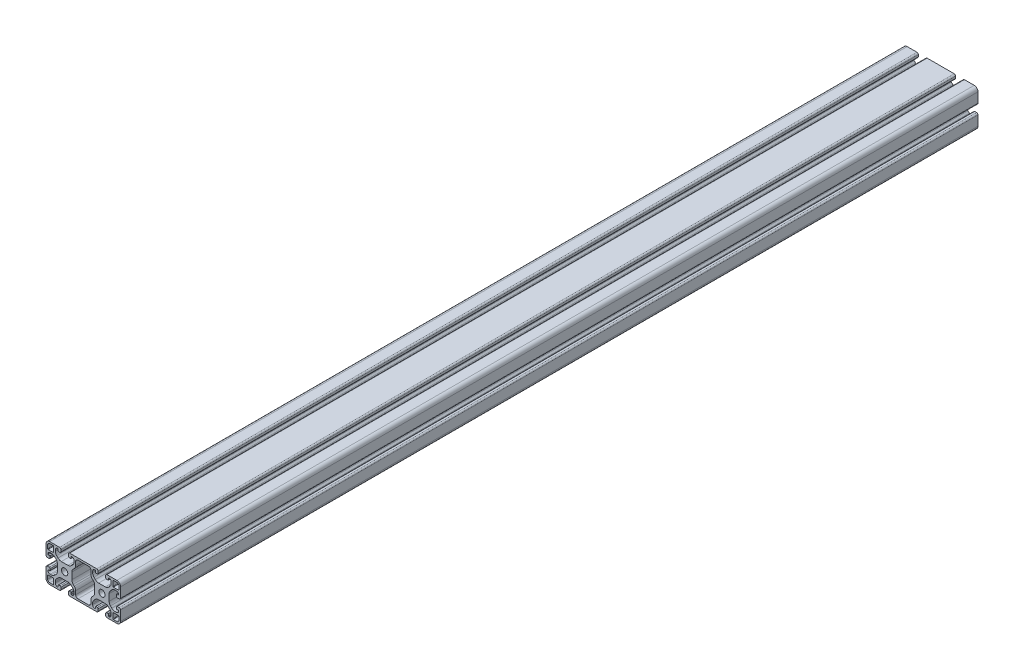
from build123d import *

# Parameters (mm, degrees)
ESQUISSE1_R        = 3.4
BOSS_EXTRU_1_DEPTH = 920


with BuildPart() as part:
    # Esquisse1 → Boss.-Extru.1 (new body)
    with BuildSketch(Plane.XY.offset(20)):
        with BuildLine():
            Line((66.5, 4.5), (65, 4.5))
            ThreePointArc((65, 4.5), (64.292893219, 4.207106781), (64, 3.5))
            Line((64, 3.5), (64, 1.5))
            ThreePointArc((64, 1.5), (64.439339828, 0.439339828), (65.5, 0))
            Line((65.5, 0), (76, 0))
            ThreePointArc((76, 0), (78.828427125, 1.171572875), (80, 4))
            Line((80, 4), (80, 14.5))
            ThreePointArc((80, 14.5), (79.560660172, 15.560660172), (78.5, 16))
            Line((78.5, 16), (76.5, 16))
            ThreePointArc((76.5, 16), (75.792893219, 15.707106781), (75.5, 15))
            Line((75.5, 15), (75.5, 13.5))
            ThreePointArc((75.5, 13.5), (75.646446609, 13.146446609), (76, 13))
            Line((76, 13), (77.5, 13))
            ThreePointArc((77.5, 13), (77.853553391, 12.853553391), (78, 12.5))
            ThreePointArc((78, 12.5), (77.267766953, 10.732233047), (75.5, 10))
            Line((75.5, 10), (74.192388155, 10))
            ThreePointArc((74.192388155, 10), (72.278970994, 10.380602337), (70.656854249, 11.464466094))
            Line((70.656854249, 11.464466094), (69.214466094, 12.906854249))
            ThreePointArc((69.214466094, 12.906854249), (68.130602337, 14.528970994), (67.75, 16.442388155))
            Line((67.75, 16.442388155), (67.75, 23.557611845))
            ThreePointArc((67.75, 23.557611845), (68.130602337, 25.471029006), (69.214466094, 27.093145751))
            Line((69.214466094, 27.093145751), (70.656854249, 28.535533906))
            ThreePointArc((70.656854249, 28.535533906), (72.278970994, 29.619397663), (74.192388155, 30))
            Line((74.192388155, 30), (75.5, 30))
            ThreePointArc((75.5, 30), (77.267766953, 29.267766953), (78, 27.5))
            ThreePointArc((78, 27.5), (77.853553391, 27.146446609), (77.5, 27))
            Line((77.5, 27), (76, 27))
            ThreePointArc((76, 27), (75.646446609, 26.853553391), (75.5, 26.5))
            Line((75.5, 26.5), (75.5, 25))
            ThreePointArc((75.5, 25), (75.792893219, 24.292893219), (76.5, 24))
            Line((76.5, 24), (78.5, 24))
            ThreePointArc((78.5, 24), (79.560660172, 24.439339828), (80, 25.5))
            Line((80, 25.5), (80, 36))
            ThreePointArc((80, 36), (78.828427125, 38.828427125), (76, 40))
            Line((76, 40), (65.5, 40))
            ThreePointArc((65.5, 40), (64.439339828, 39.560660172), (64, 38.5))
            Line((64, 38.5), (64, 36.5))
            ThreePointArc((64, 36.5), (64.292893219, 35.792893219), (65, 35.5))
            Line((65, 35.5), (66.5, 35.5))
            ThreePointArc((66.5, 35.5), (66.853553391, 35.646446609), (67, 36))
            Line((67, 36), (67, 37.5))
            ThreePointArc((67, 37.5), (67.146446609, 37.853553391), (67.5, 38))
            ThreePointArc((67.5, 38), (69.267766953, 37.267766953), (70, 35.5))
            Line((70, 35.5), (70, 34.192388155))
            ThreePointArc((70, 34.192388155), (69.619397663, 32.278970994), (68.535533906, 30.656854249))
            Line((68.535533906, 30.656854249), (67.093145751, 29.214466094))
            ThreePointArc((67.093145751, 29.214466094), (65.471029006, 28.130602337), (63.557611845, 27.75))
            Line((63.557611845, 27.75), (56.442388155, 27.75))
            ThreePointArc((56.442388155, 27.75), (54.528970994, 28.130602337), (52.906854249, 29.214466094))
            Line((52.906854249, 29.214466094), (51.464466094, 30.656854249))
            ThreePointArc((51.464466094, 30.656854249), (50.380602337, 32.278970994), (50, 34.192388155))
            Line((50, 34.192388155), (50, 35.5))
            ThreePointArc((50, 35.5), (50.732233047, 37.267766953), (52.5, 38))
            ThreePointArc((52.5, 38), (52.853553391, 37.853553391), (53, 37.5))
            Line((53, 37.5), (53, 36))
            ThreePointArc((53, 36), (53.146446609, 35.646446609), (53.5, 35.5))
            Line((53.5, 35.5), (55, 35.5))
            ThreePointArc((55, 35.5), (55.707106781, 35.792893219), (56, 36.5))
            Line((56, 36.5), (56, 38.5))
            ThreePointArc((56, 38.5), (55.560660172, 39.560660172), (54.5, 40))
            Line((54.5, 40), (25.5, 40))
            ThreePointArc((25.5, 40), (24.439339828, 39.560660172), (24, 38.5))
            Line((24, 38.5), (24, 36.5))
            ThreePointArc((24, 36.5), (24.292893219, 35.792893219), (25, 35.5))
            Line((25, 35.5), (26.5, 35.5))
            ThreePointArc((26.5, 35.5), (26.853553391, 35.646446609), (27, 36))
            Line((27, 36), (27, 37.5))
            ThreePointArc((27, 37.5), (27.146446609, 37.853553391), (27.5, 38))
            ThreePointArc((27.5, 38), (29.267766953, 37.267766953), (30, 35.5))
            Line((30, 35.5), (30, 34.192388155))
            ThreePointArc((30, 34.192388155), (29.619397663, 32.278970994), (28.535533906, 30.656854249))
            Line((28.535533906, 30.656854249), (27.093145751, 29.214466094))
            ThreePointArc((27.093145751, 29.214466094), (25.471029006, 28.130602337), (23.557611845, 27.75))
            Line((23.557611845, 27.75), (16.442388155, 27.75))
            ThreePointArc((16.442388155, 27.75), (14.528970994, 28.130602337), (12.906854249, 29.214466094))
            Line((12.906854249, 29.214466094), (11.464466094, 30.656854249))
            ThreePointArc((11.464466094, 30.656854249), (10.380602337, 32.278970994), (10, 34.192388155))
            Line((10, 34.192388155), (10, 35.5))
            ThreePointArc((10, 35.5), (10.732233047, 37.267766953), (12.5, 38))
            ThreePointArc((12.5, 38), (12.853553391, 37.853553391), (13, 37.5))
            Line((13, 37.5), (13, 36))
            ThreePointArc((13, 36), (13.146446609, 35.646446609), (13.5, 35.5))
            Line((13.5, 35.5), (15, 35.5))
            ThreePointArc((15, 35.5), (15.707106781, 35.792893219), (16, 36.5))
            Line((16, 36.5), (16, 38.5))
            ThreePointArc((16, 38.5), (15.560660172, 39.560660172), (14.5, 40))
            Line((14.5, 40), (4, 40))
            ThreePointArc((4, 40), (1.171572875, 38.828427125), (0, 36))
            Line((0, 36), (0, 25.5))
            ThreePointArc((0, 25.5), (0.439339828, 24.439339828), (1.5, 24))
            Line((1.5, 24), (3.5, 24))
            ThreePointArc((3.5, 24), (4.207106781, 24.292893219), (4.5, 25))
            Line((4.5, 25), (4.5, 26.5))
            ThreePointArc((4.5, 26.5), (4.353553391, 26.853553391), (4, 27))
            Line((4, 27), (2.5, 27))
            ThreePointArc((2.5, 27), (2.146446609, 27.146446609), (2, 27.5))
            ThreePointArc((2, 27.5), (2.732233047, 29.267766953), (4.5, 30))
            Line((4.5, 30), (5.807611845, 30))
            ThreePointArc((5.807611845, 30), (7.721029006, 29.619397663), (9.343145751, 28.535533906))
            Line((9.343145751, 28.535533906), (10.785533906, 27.093145751))
            ThreePointArc((10.785533906, 27.093145751), (11.869397663, 25.471029006), (12.25, 23.557611845))
            Line((12.25, 23.557611845), (12.25, 16.442388155))
            ThreePointArc((12.25, 16.442388155), (11.869397663, 14.528970994), (10.785533906, 12.906854249))
            Line((10.785533906, 12.906854249), (9.343145751, 11.464466094))
            ThreePointArc((9.343145751, 11.464466094), (7.721029006, 10.380602337), (5.807611845, 10))
            Line((5.807611845, 10), (4.5, 10))
            ThreePointArc((4.5, 10), (2.732233047, 10.732233047), (2, 12.5))
            ThreePointArc((2, 12.5), (2.146446609, 12.853553391), (2.5, 13))
            Line((2.5, 13), (4, 13))
            ThreePointArc((4, 13), (4.353553391, 13.146446609), (4.5, 13.5))
            Line((4.5, 13.5), (4.5, 15))
            ThreePointArc((4.5, 15), (4.207106781, 15.707106781), (3.5, 16))
            Line((3.5, 16), (1.5, 16))
            ThreePointArc((1.5, 16), (0.439339828, 15.560660172), (0, 14.5))
            Line((0, 14.5), (0, 4))
            ThreePointArc((0, 4), (1.171572875, 1.171572875), (4, 0))
            Line((4, 0), (14.5, 0))
            ThreePointArc((14.5, 0), (15.560660172, 0.439339828), (16, 1.5))
            Line((16, 1.5), (16, 3.5))
            ThreePointArc((16, 3.5), (15.707106781, 4.207106781), (15, 4.5))
            Line((15, 4.5), (13.5, 4.5))
            ThreePointArc((13.5, 4.5), (13.146446609, 4.353553391), (13, 4))
            Line((13, 4), (13, 2.5))
            ThreePointArc((13, 2.5), (12.853553391, 2.146446609), (12.5, 2))
            ThreePointArc((12.5, 2), (10.732233047, 2.732233047), (10, 4.5))
            Line((10, 4.5), (10, 5.807611845))
            ThreePointArc((10, 5.807611845), (10.380602337, 7.721029006), (11.464466094, 9.343145751))
            Line((11.464466094, 9.343145751), (12.906854249, 10.785533906))
            ThreePointArc((12.906854249, 10.785533906), (14.528970994, 11.869397663), (16.442388155, 12.25))
            Line((16.442388155, 12.25), (23.557611845, 12.25))
            ThreePointArc((23.557611845, 12.25), (25.471029006, 11.869397663), (27.093145751, 10.785533906))
            Line((27.093145751, 10.785533906), (28.535533906, 9.343145751))
            ThreePointArc((28.535533906, 9.343145751), (29.619397663, 7.721029006), (30, 5.807611845))
            Line((30, 5.807611845), (30, 4.5))
            ThreePointArc((30, 4.5), (29.267766953, 2.732233047), (27.5, 2))
            ThreePointArc((27.5, 2), (27.146446609, 2.146446609), (27, 2.5))
            Line((27, 2.5), (27, 4))
            ThreePointArc((27, 4), (26.853553391, 4.353553391), (26.5, 4.5))
            Line((26.5, 4.5), (25, 4.5))
            ThreePointArc((25, 4.5), (24.292893219, 4.207106781), (24, 3.5))
            Line((24, 3.5), (24, 1.5))
            ThreePointArc((24, 1.5), (24.439339828, 0.439339828), (25.5, 0))
            Line((25.5, 0), (54.5, 0))
            ThreePointArc((54.5, 0), (55.560660172, 0.439339828), (56, 1.5))
            Line((56, 1.5), (56, 3.5))
            ThreePointArc((56, 3.5), (55.707106781, 4.207106781), (55, 4.5))
            Line((55, 4.5), (53.5, 4.5))
            ThreePointArc((53.5, 4.5), (53.146446609, 4.353553391), (53, 4))
            Line((53, 4), (53, 2.5))
            ThreePointArc((53, 2.5), (52.853553391, 2.146446609), (52.5, 2))
            ThreePointArc((52.5, 2), (50.732233047, 2.732233047), (50, 4.5))
            Line((50, 4.5), (50, 5.807611845))
            ThreePointArc((50, 5.807611845), (50.380602337, 7.721029006), (51.464466094, 9.343145751))
            Line((51.464466094, 9.343145751), (52.906854249, 10.785533906))
            ThreePointArc((52.906854249, 10.785533906), (54.528970994, 11.869397663), (56.442388155, 12.25))
            Line((56.442388155, 12.25), (63.557611845, 12.25))
            ThreePointArc((63.557611845, 12.25), (65.471029006, 11.869397663), (67.093145751, 10.785533906))
            Line((67.093145751, 10.785533906), (68.535533906, 9.343145751))
            ThreePointArc((68.535533906, 9.343145751), (69.619397663, 7.721029006), (70, 5.807611845))
            Line((70, 5.807611845), (70, 4.5))
            ThreePointArc((70, 4.5), (69.267766953, 2.732233047), (67.5, 2))
            ThreePointArc((67.5, 2), (67.146446609, 2.146446609), (67, 2.5))
            Line((67, 2.5), (67, 4))
            ThreePointArc((67, 4), (66.853553391, 4.353553391), (66.5, 4.5))
        make_face()
        with Locations(Location((20, 20, 0), (0, 0, 180))):
            Circle(ESQUISSE1_R, mode=Mode.SUBTRACT)
        with Locations(Location((60, 20, 0), (0, 0, 180))):
            Circle(ESQUISSE1_R, mode=Mode.SUBTRACT)
        with BuildLine():
            Line((31.8, 4.5), (31.8, 8.250252532))
            ThreePointArc((31.8, 8.250252532), (31.419397663, 10.163669694), (30.335533906, 11.785786438))
            Line((30.335533906, 11.785786438), (29.214466094, 12.906854249))
            ThreePointArc((29.214466094, 12.906854249), (28.130602337, 14.528970994), (27.75, 16.442388155))
            Line((27.75, 16.442388155), (27.75, 23.557611845))
            ThreePointArc((27.75, 23.557611845), (28.130602337, 25.471029006), (29.214466094, 27.093145751))
            Line((29.214466094, 27.093145751), (30.335533906, 28.214213562))
            ThreePointArc((30.335533906, 28.214213562), (31.419397663, 29.836330306), (31.8, 31.749747468))
            Line((31.8, 31.749747468), (31.8, 35.5))
            ThreePointArc((31.8, 35.5), (32.532233047, 37.267766953), (34.3, 38))
            Line((34.3, 38), (45.7, 38))
            ThreePointArc((45.7, 38), (47.467766953, 37.267766953), (48.2, 35.5))
            Line((48.2, 35.5), (48.2, 31.749747468))
            ThreePointArc((48.2, 31.749747468), (48.580602337, 29.836330306), (49.664466094, 28.214213562))
            Line((49.664466094, 28.214213562), (50.785533906, 27.093145751))
            ThreePointArc((50.785533906, 27.093145751), (51.869397663, 25.471029006), (52.25, 23.557611845))
            Line((52.25, 23.557611845), (52.25, 16.442388155))
            ThreePointArc((52.25, 16.442388155), (51.869397663, 14.528970994), (50.785533906, 12.906854249))
            Line((50.785533906, 12.906854249), (49.664466094, 11.785786438))
            ThreePointArc((49.664466094, 11.785786438), (48.580602337, 10.163669694), (48.2, 8.250252532))
            Line((48.2, 8.250252532), (48.2, 4.5))
            ThreePointArc((48.2, 4.5), (47.467766953, 2.732233047), (45.7, 2))
            Line((45.7, 2), (34.3, 2))
            ThreePointArc((34.3, 2), (32.532233047, 2.732233047), (31.8, 4.5))
        make_face(mode=Mode.SUBTRACT)
        with BuildLine():
            Line((7.7, 1.8), (4, 1.8))
            ThreePointArc((4, 1.8), (2.444365081, 2.444365081), (1.8, 4))
            Line((1.8, 4), (1.8, 7.7))
            ThreePointArc((1.8, 7.7), (1.946446609, 8.053553391), (2.3, 8.2))
            Line((2.3, 8.2), (7.7, 8.2))
            ThreePointArc((7.7, 8.2), (8.053553391, 8.053553391), (8.2, 7.7))
            Line((8.2, 7.7), (8.2, 2.3))
            ThreePointArc((8.2, 2.3), (8.053553391, 1.946446609), (7.7, 1.8))
        make_face(mode=Mode.SUBTRACT)
        with BuildLine():
            Line((72.3, 38.2), (76, 38.2))
            ThreePointArc((76, 38.2), (77.555634919, 37.555634919), (78.2, 36))
            Line((78.2, 36), (78.2, 32.3))
            ThreePointArc((78.2, 32.3), (78.053553391, 31.946446609), (77.7, 31.8))
            Line((77.7, 31.8), (72.3, 31.8))
            ThreePointArc((72.3, 31.8), (71.946446609, 31.946446609), (71.8, 32.3))
            Line((71.8, 32.3), (71.8, 37.7))
            ThreePointArc((71.8, 37.7), (71.946446609, 38.053553391), (72.3, 38.2))
        make_face(mode=Mode.SUBTRACT)
        with BuildLine():
            Line((78.2, 7.7), (78.2, 4))
            ThreePointArc((78.2, 4), (77.555634919, 2.444365081), (76, 1.8))
            Line((76, 1.8), (72.3, 1.8))
            ThreePointArc((72.3, 1.8), (71.946446609, 1.946446609), (71.8, 2.3))
            Line((71.8, 2.3), (71.8, 7.7))
            ThreePointArc((71.8, 7.7), (71.946446609, 8.053553391), (72.3, 8.2))
            Line((72.3, 8.2), (77.7, 8.2))
            ThreePointArc((77.7, 8.2), (78.053553391, 8.053553391), (78.2, 7.7))
        make_face(mode=Mode.SUBTRACT)
        with BuildLine():
            Line((1.8, 32.3), (1.8, 36))
            ThreePointArc((1.8, 36), (2.444365081, 37.555634919), (4, 38.2))
            Line((4, 38.2), (7.7, 38.2))
            ThreePointArc((7.7, 38.2), (8.053553391, 38.053553391), (8.2, 37.7))
            Line((8.2, 37.7), (8.2, 32.3))
            ThreePointArc((8.2, 32.3), (8.053553391, 31.946446609), (7.7, 31.8))
            Line((7.7, 31.8), (2.3, 31.8))
            ThreePointArc((2.3, 31.8), (1.946446609, 31.946446609), (1.8, 32.3))
        make_face(mode=Mode.SUBTRACT)
    extrude(amount=-BOSS_EXTRU_1_DEPTH)


solid = part.part
